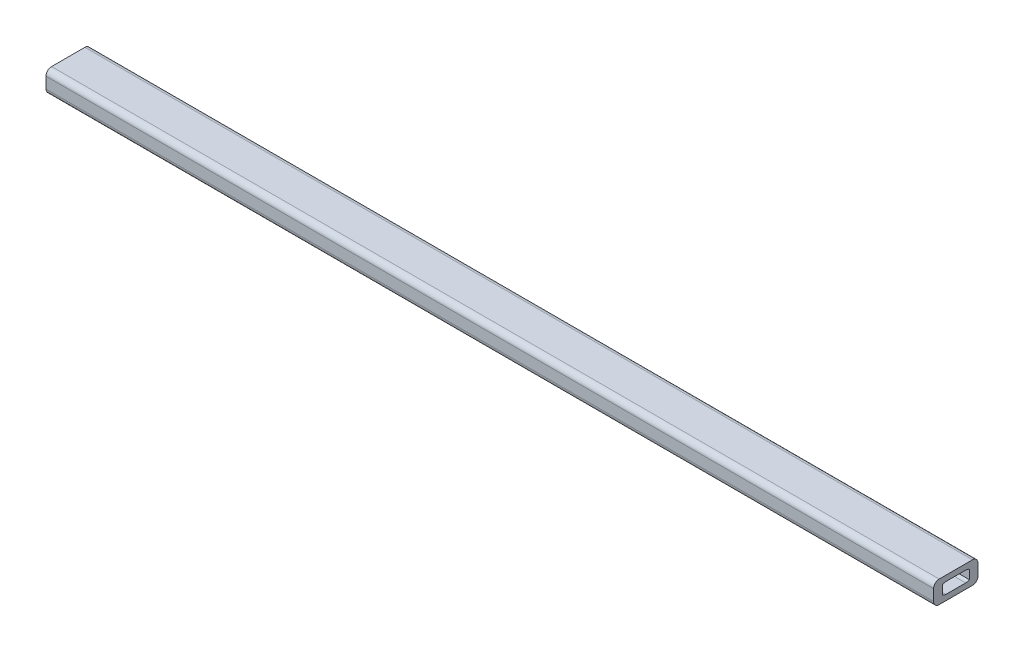
from build123d import *

# Parameters (mm, degrees)
BOSS_EXTRUDE1_DEPTH = 400


with BuildPart() as part:
    # Sketch1 → Boss-Extrude1 (new, symmetric)
    with BuildSketch(Plane(origin=(0, 0, 0), x_dir=(0, 0, -1), z_dir=(1, 0, 0))):
        with BuildLine():
            Line((-15, 10), (15, 10))
            ThreePointArc((15, 10), (18.535533906, 8.535533906), (20, 5))
            Line((20, 5), (20, -5))
            ThreePointArc((20, -5), (18.535533906, -8.535533906), (15, -10))
            Line((15, -10), (-15, -10))
            ThreePointArc((-15, -10), (-18.535533906, -8.535533906), (-20, -5))
            Line((-20, -5), (-20, 5))
            ThreePointArc((-20, 5), (-18.535533906, 8.535533906), (-15, 10))
        make_face()
        with BuildLine():
            Line((12.148766077, 4.049588692), (12.148766077, -4.049588692))
            ThreePointArc((12.148766077, -4.049588692), (10.577040219, -4.75760445), (8.870332019, -5))
            Line((8.870332019, -5), (-8.870332019, -5))
            ThreePointArc((-8.870332019, -5), (-10.577040219, -4.75760445), (-12.148766077, -4.049588692))
            Line((-12.148766077, -4.049588692), (-12.148766077, 4.049588692))
            ThreePointArc((-12.148766077, 4.049588692), (-10.577040219, 4.75760445), (-8.870332019, 5))
            Line((-8.870332019, 5), (8.870332019, 5))
            ThreePointArc((8.870332019, 5), (10.577040219, 4.75760445), (12.148766077, 4.049588692))
        make_face(mode=Mode.SUBTRACT)
    extrude(amount=BOSS_EXTRUDE1_DEPTH, both=True)


solid = part.part
